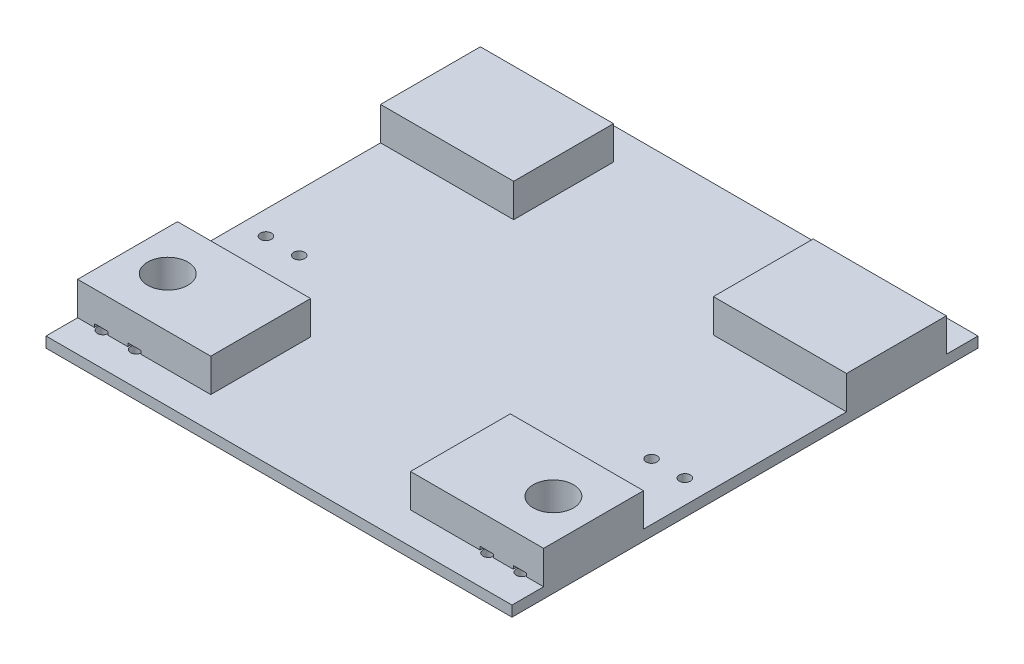
from build123d import *

# Parameters (mm, degrees)
SKETCH1_W           = 140
SKETCH1_H           = 140
BOSS_EXTRUDE1_DEPTH = 3.175
SKETCH2_W           = 30
SKETCH2_H           = 30
BOSS_EXTRUDE2_DEPTH = 10
SKETCH11_W          = 30
SKETCH11_H          = 10
BOSS_EXTRUDE3_DEPTH = 10
SKETCH13_W          = 30
SKETCH13_H          = 10
BOSS_EXTRUDE4_DEPTH = 10
SKETCH16_W          = 30
SKETCH16_H          = 10
BOSS_EXTRUDE6_DEPTH = 10
SKETCH17_W          = 30
SKETCH17_H          = 10
BOSS_EXTRUDE7_DEPTH = 10
SKETCH18_R          = 6.05
CUT_EXTRUDE1_DEPTH  = 13.175
SKETCH21_R          = 1.65
CUT_EXTRUDE2_DEPTH  = 3.175
SKETCH22_R          = 2.05
CUT_EXTRUDE3_DEPTH  = 1


with BuildPart() as part:
    # Sketch1 → Boss-Extrude1 (new body)
    with BuildSketch(Plane(origin=(0, 0, 0), x_dir=(1, 0, 0), z_dir=(0, 1, 0))):
        Rectangle(SKETCH1_W, SKETCH1_H)
    extrude(amount=BOSS_EXTRUDE1_DEPTH)

    # Sketch2 → Boss-Extrude2 (add)
    with BuildSketch(Plane(origin=(0, 3.175, 0), x_dir=(1, 0, 0), z_dir=(0, 1, 0))):
        with Locations((45, -45.5)):
            Rectangle(SKETCH2_W, SKETCH2_H)
        with Locations((-45, -45.5)):
            Rectangle(SKETCH2_W, SKETCH2_H)
        with Locations((-45, 45.5)):
            Rectangle(SKETCH2_W, SKETCH2_H)
    boss_extrude2 = extrude(amount=BOSS_EXTRUDE2_DEPTH)

    # Sketch11 → Boss-Extrude3 (add)
    with BuildSketch(Plane.ZY.offset(60)):
        with Locations((45.5, 8.175)):
            Rectangle(SKETCH11_W, SKETCH11_H)
    extrude(amount=BOSS_EXTRUDE3_DEPTH)

    # Sketch13 → Boss-Extrude4 (add)
    with BuildSketch(Plane(origin=(60, 0, 0), x_dir=(0, 0, -1), z_dir=(1, 0, 0))):
        with Locations((-45.5, 8.175)):
            Rectangle(SKETCH13_W, SKETCH13_H)
    extrude(amount=BOSS_EXTRUDE4_DEPTH)

    # Mirror1: Boss-Extrude2 across plane
    add(boss_extrude2.mirror(Plane(origin=(0, 0, 0), x_dir=(0, 0, 1), z_dir=(1, 0, 0))))

    # Sketch16 → Boss-Extrude6 (add)
    with BuildSketch(Plane(origin=(60, 0, 0), x_dir=(0, 0, -1), z_dir=(1, 0, 0))):
        with Locations((45.5, 8.175)):
            Rectangle(SKETCH16_W, SKETCH16_H)
    extrude(amount=BOSS_EXTRUDE6_DEPTH)

    # Sketch17 → Boss-Extrude7 (add)
    with BuildSketch(Plane.ZY.offset(60)):
        with Locations((-45.5, 8.175)):
            Rectangle(SKETCH17_W, SKETCH17_H)
    extrude(amount=BOSS_EXTRUDE7_DEPTH)

    # Sketch18 → Cut-Extrude1 (cut)
    with BuildSketch(Plane(origin=(0, 13.175, 0), x_dir=(1, 0, 0), z_dir=(0, 1, 0))):
        with Locations(Location((-57.9286, -45.5, 0), (0, 0, 270))):
            Circle(SKETCH18_R)
        with Locations(Location((57.9286, -45.5, 0), (0, 0, 90))):
            Circle(SKETCH18_R)
    extrude(amount=-CUT_EXTRUDE1_DEPTH, mode=Mode.SUBTRACT)

    # Sketch21 → Cut-Extrude2 (cut)
    with BuildSketch(Plane(origin=(0, 0, 0), x_dir=(-1, 0, 0), z_dir=(0, -1, 0))):
        with Locations(Location((-62.9286, -11, 0), (0, 0, 90))):
            Circle(SKETCH21_R)
        with Locations(Location((-52.9286, -11, 0), (0, 0, 90))):
            Circle(SKETCH21_R)
        with Locations(Location((-62.9286, -60, 0), (0, 0, 90))):
            Circle(SKETCH21_R)
        with Locations(Location((-52.9286, -60, 0), (0, 0, 90))):
            Circle(SKETCH21_R)
        with Locations(Location((52.9286, -11, 0), (0, 0, 90))):
            Circle(SKETCH21_R)
        with Locations(Location((62.9286, -11, 0), (0, 0, 90))):
            Circle(SKETCH21_R)
        with Locations(Location((52.9286, -60, 0), (0, 0, 90))):
            Circle(SKETCH21_R)
        with Locations(Location((62.9286, -60, 0), (0, 0, 90))):
            Circle(SKETCH21_R)
    extrude(amount=-CUT_EXTRUDE2_DEPTH, mode=Mode.SUBTRACT)

    # Sketch22 → Cut-Extrude3 (cut)
    with BuildSketch(Plane(origin=(0, 3.175, 0), x_dir=(-1, 0, 0), z_dir=(0, -1, 0))):
        with Locations((62.9286, -60)):
            Circle(SKETCH22_R)
        with Locations((52.9286, -60)):
            Circle(SKETCH22_R)
        with Locations((-52.9286, -60)):
            Circle(SKETCH22_R)
        with Locations((-62.9286, -60)):
            Circle(SKETCH22_R)
    extrude(amount=-CUT_EXTRUDE3_DEPTH, mode=Mode.SUBTRACT)


solid = part.part
